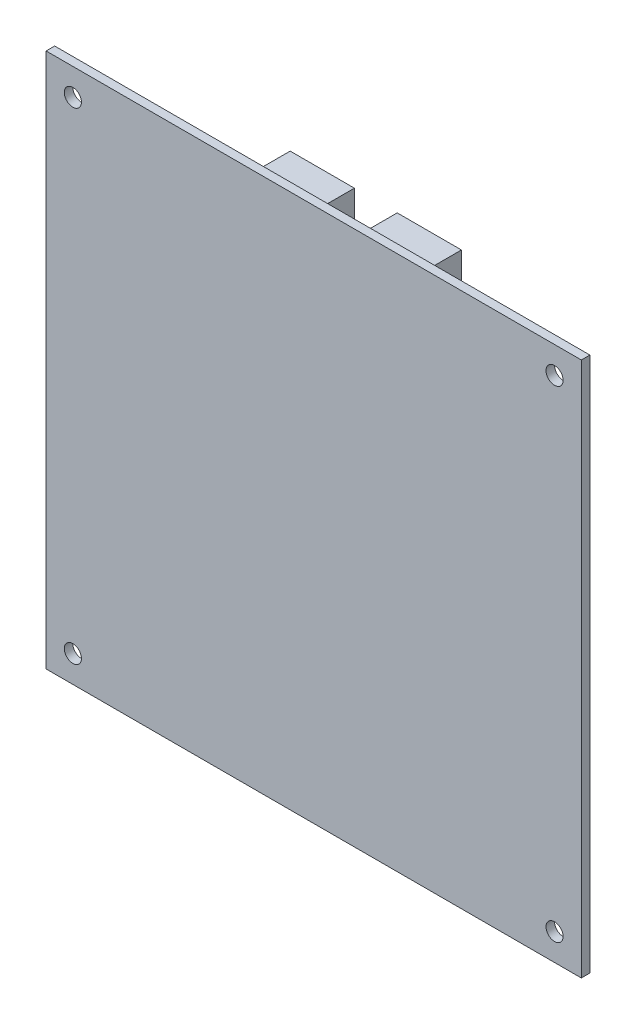
from build123d import *

# Parameters (mm, degrees)
SKETCH_1_W          = 100
SKETCH_1_H          = 100
SKETCH_1_R          = 1.6
F_100X100_1P6_DEPTH = 1.6
EXTRUDE_START       = -8
SKETCH_2_W          = 4
SKETCH_2_H          = 58
EXTRUDE_284_DEPTH   = 8
SKETCH_3_W          = 4
SKETCH_3_H          = 58
EXTRUDE_361_DEPTH   = 8
EXTRUDE_START_2     = -16
SKETCH_4_W          = 32
SKETCH_4_H          = 47
EXTRUDE_435_DEPTH   = 16
EXTRUDE_START_3     = -12
SKETCH_5_W          = 20
SKETCH_5_H          = 10
EXTRUDE_509_DEPTH   = 12
EXTRUDE_START_4     = -10
SKETCH_6_W          = 12
SKETCH_6_H          = 10
EXTRUDE_583_DEPTH   = 10
SKETCH_7_W          = 12
SKETCH_7_H          = 10
EXTRUDE_657_DEPTH   = 10


with BuildPart() as part:
    # 草图1 → 100x100_板厚1p6 (new body)
    with BuildSketch(Plane.XY):
        with Locations((50, 50)):
            Rectangle(SKETCH_1_W, SKETCH_1_H)
        with Locations((5, 5)):
            Circle(SKETCH_1_R, mode=Mode.SUBTRACT)
        with Locations((95, 5)):
            Circle(SKETCH_1_R, mode=Mode.SUBTRACT)
        with Locations((5, 95)):
            Circle(SKETCH_1_R, mode=Mode.SUBTRACT)
        with Locations((95, 95)):
            Circle(SKETCH_1_R, mode=Mode.SUBTRACT)
    extrude(amount=F_100X100_1P6_DEPTH)

    # 草图2 → Extrude 284 (add)
    with BuildSketch(Plane.XY.offset(EXTRUDE_START)):
        with Locations((28, 49)):
            Rectangle(SKETCH_2_W, SKETCH_2_H)
    extrude(amount=EXTRUDE_284_DEPTH)

    # 草图3 → Extrude 361 (add)
    with BuildSketch(Plane.XY.offset(EXTRUDE_START)):
        with Locations((72, 49)):
            Rectangle(SKETCH_3_W, SKETCH_3_H)
    extrude(amount=EXTRUDE_361_DEPTH)

    # 草图4 → Extrude 435 (add)
    with BuildSketch(Plane.XY.offset(EXTRUDE_START_2)):
        with Locations((50, 49.5)):
            Rectangle(SKETCH_4_W, SKETCH_4_H)
    extrude(amount=EXTRUDE_435_DEPTH)

    # 草图5 → Extrude 509 (add)
    with BuildSketch(Plane.XY.offset(EXTRUDE_START_3)):
        with Locations((50, 8)):
            Rectangle(SKETCH_5_W, SKETCH_5_H)
    extrude(amount=EXTRUDE_509_DEPTH)

    # 草图6 → Extrude 583 (add)
    with BuildSketch(Plane.XY.offset(EXTRUDE_START_4)):
        with Locations((40, 90)):
            Rectangle(SKETCH_6_W, SKETCH_6_H)
    extrude(amount=EXTRUDE_583_DEPTH)

    # 草图7 → Extrude 657 (add)
    with BuildSketch(Plane.XY.offset(EXTRUDE_START_4)):
        with Locations((60, 90)):
            Rectangle(SKETCH_7_W, SKETCH_7_H)
    extrude(amount=EXTRUDE_657_DEPTH)


solid = part.part
